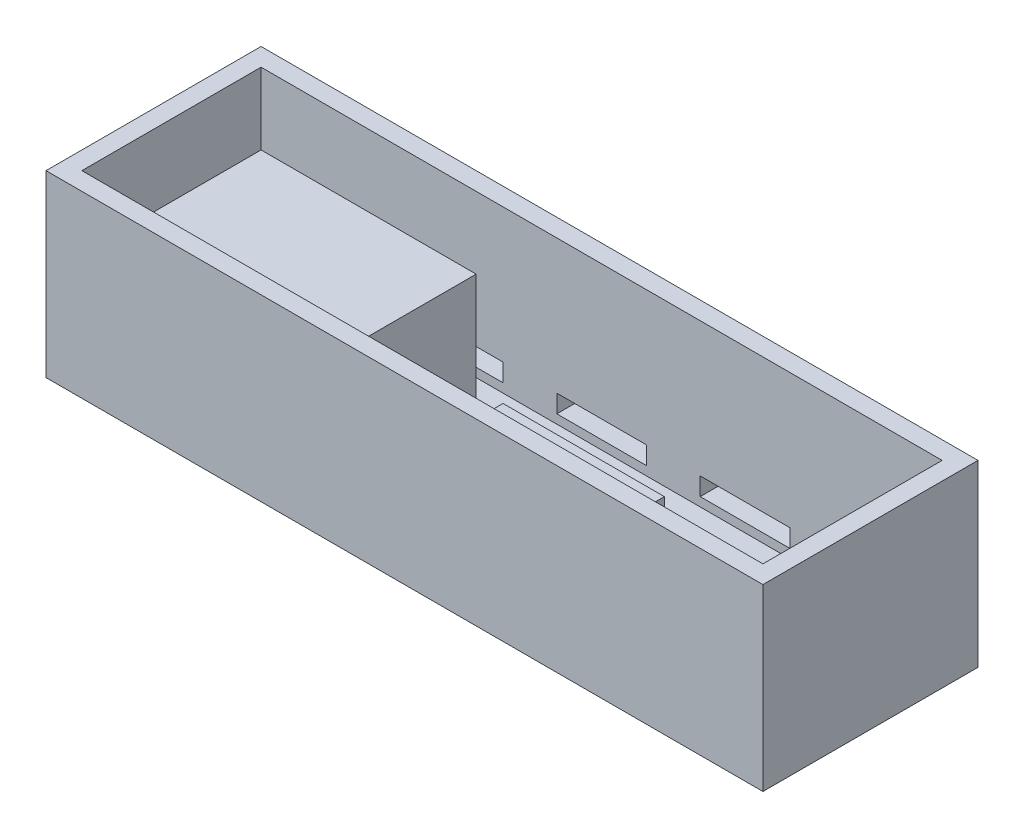
from build123d import *

# Parameters (mm, degrees)
ESQUISSE1_W                = 400
ESQUISSE1_H                = 120
BOSS_EXTRU_1_DEPTH         = 100
ESQUISSE2_W                = 380
ESQUISSE2_H                = 100
ENL_V_MAT_EXTRU_1_DEPTH    = 90
ESQUISSE3_W                = 120
ESQUISSE3_H                = 80
BOSS_EXTRU_2_DEPTH         = 60
ESQUISSE4_W                = 90
ESQUISSE4_H                = 50
BOSS_EXTRU_3_DEPTH         = 20
ESQUISSE5_W                = 60
ESQUISSE5_H                = 20
BOSS_EXTRU_4_DEPTH         = 20
ESQUISSE9_W                = 50
ESQUISSE9_H                = 10
ENL_V_MAT_EXTRU_3_DEPTH    = 10
R_P_TITION_LIN_AIRE1_COUNT = 5
R_P_TITION_LIN_AIRE1_PITCH = 80


with BuildPart() as part:
    # Esquisse1 → Boss.-Extru.1 (new body)
    with BuildSketch(Plane(origin=(0, 0, 0), x_dir=(1, 0, 0), z_dir=(0, 1, 0))):
        with Locations((200, 60)):
            Rectangle(ESQUISSE1_W, ESQUISSE1_H)
    extrude(amount=BOSS_EXTRU_1_DEPTH)

    # Esquisse2 → Enlèv. mat.-Extru.1 (cut)
    with BuildSketch(Plane(origin=(0, 100, 0), x_dir=(1, 0, 0), z_dir=(0, 1, 0))):
        with Locations((200, 60)):
            Rectangle(ESQUISSE2_W, ESQUISSE2_H)
    extrude(amount=-ENL_V_MAT_EXTRU_1_DEPTH, mode=Mode.SUBTRACT)

    # Esquisse3 → Boss.-Extru.2 (add)
    with BuildSketch(Plane(origin=(0, 10, 0), x_dir=(1, 0, 0), z_dir=(0, 1, 0))):
        with Locations((80, 60)):
            Rectangle(ESQUISSE3_W, ESQUISSE3_H)
    extrude(amount=BOSS_EXTRU_2_DEPTH)

    # Esquisse4 → Boss.-Extru.3 (add)
    with BuildSketch(Plane(origin=(0, 10, 0), x_dir=(1, 0, 0), z_dir=(0, 1, 0))):
        with Locations((215, 60)):
            Rectangle(ESQUISSE4_W, ESQUISSE4_H)
    extrude(amount=BOSS_EXTRU_3_DEPTH)

    # Esquisse5 → Boss.-Extru.4 (add)
    with BuildSketch(Plane(origin=(0, 10, 0), x_dir=(1, 0, 0), z_dir=(0, 1, 0))):
        with Locations((320, 60)):
            Rectangle(ESQUISSE5_W, ESQUISSE5_H)
    extrude(amount=BOSS_EXTRU_4_DEPTH)

    # Esquisse9 → Enlèv. mat.-Extru.3 (cut)
    with BuildSketch(Plane(origin=(0, 0, -120), x_dir=(-1, 0, 0), z_dir=(0, 0, -1))):
        with Locations((-360, 20)):
            Rectangle(ESQUISSE9_W, ESQUISSE9_H)
    enl_v_mat_extru_3 = extrude(amount=-ENL_V_MAT_EXTRU_3_DEPTH, mode=Mode.SUBTRACT)

    # Répétition linéaire1: Enlèv. mat.-Extru.3 ×5
    with Locations(*[(-i * R_P_TITION_LIN_AIRE1_PITCH, 0, 0) for i in range(1, R_P_TITION_LIN_AIRE1_COUNT)]):
        add(enl_v_mat_extru_3, mode=Mode.SUBTRACT)


solid = part.part
